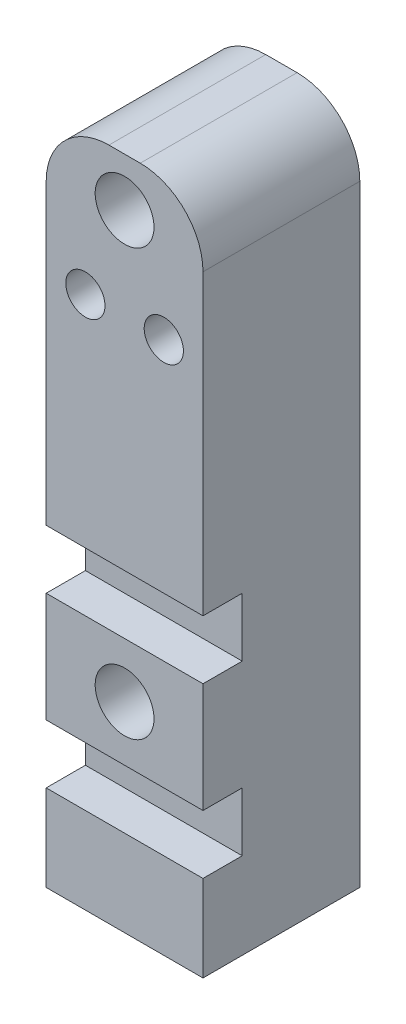
from build123d import *

# Parameters (mm, degrees)
SKETCH1_W           = 1
SKETCH1_H           = 1
BOSS_EXTRUDE1_DEPTH = 4.3
FILLET1_R           = 0.4
FILLET2_R           = 0.4
SKETCH2_R           = 0.1
CUT_EXTRUDE1_DEPTH  = 0.7
SKETCH6_W           = 1
SKETCH6_H           = 0.375
CUT_EXTRUDE2_DEPTH  = 0.25
SKETCH8_W           = 1
SKETCH8_H           = 0.375
CUT_EXTRUDE3_DEPTH  = 0.25
SKETCH9_R           = 0.1875
CUT_EXTRUDE4_DEPTH  = 1
SKETCH10_R          = 0.1875
CUT_EXTRUDE5_DEPTH  = 0.65
SKETCH11_R          = 0.125
CUT_EXTRUDE6_DEPTH  = 1


with BuildPart() as part:
    # Sketch1 → Boss-Extrude1 (new body)
    with BuildSketch(Plane(origin=(0, 0, 0), x_dir=(1, 0, 0), z_dir=(0, 1, 0))):
        Rectangle(SKETCH1_W, SKETCH1_H)
    extrude(amount=BOSS_EXTRUDE1_DEPTH)

    # Fillet1
    fillet1_edges = [part.edges().sort_by_distance(p)[0] for p in [
        (0.5, 4.3, 0),
    ]]
    fillet(fillet1_edges, radius=FILLET1_R)

    # Fillet2
    fillet2_edges = [part.edges().sort_by_distance(p)[0] for p in [
        (-0.5, 4.3, 0),
    ]]
    fillet(fillet2_edges, radius=FILLET2_R)

    # Sketch2 → Cut-Extrude1 (cut)
    with BuildSketch(Plane(origin=(0, 0, 0), x_dir=(1, 0, 0), z_dir=(0, 1, 0))):
        with Locations(Location((0, 0, 0), (0, 0, 270))):
            Circle(SKETCH2_R)
    extrude(amount=CUT_EXTRUDE1_DEPTH, mode=Mode.SUBTRACT)

    # Sketch6 → Cut-Extrude2 (cut)
    with BuildSketch(Plane.XY.offset(0.5)):
        with Locations((0, 0.7375)):
            Rectangle(SKETCH6_W, SKETCH6_H)
    extrude(amount=-CUT_EXTRUDE2_DEPTH, mode=Mode.SUBTRACT)

    # Sketch8 → Cut-Extrude3 (cut)
    with BuildSketch(Plane.XY.offset(0.5)):
        with Locations((0, 1.8125)):
            Rectangle(SKETCH8_W, SKETCH8_H)
    extrude(amount=-CUT_EXTRUDE3_DEPTH, mode=Mode.SUBTRACT)

    # Sketch9 → Cut-Extrude4 (cut)
    with BuildSketch(Plane.XY.offset(0.5)):
        with Locations((0, 1.275)):
            Circle(SKETCH9_R)
    extrude(amount=-CUT_EXTRUDE4_DEPTH, mode=Mode.SUBTRACT)

    # Sketch10 → Cut-Extrude5 (cut)
    with BuildSketch(Plane.XY.offset(0.5)):
        with Locations((0, 3.99)):
            Circle(SKETCH10_R)
    extrude(amount=-CUT_EXTRUDE5_DEPTH, mode=Mode.SUBTRACT)

    # Sketch11 → Cut-Extrude6 (cut)
    with BuildSketch(Plane.XY.offset(0.5)):
        with Locations((0.25, 3.4)):
            Circle(SKETCH11_R)
        with Locations((-0.25, 3.4)):
            Circle(SKETCH11_R)
    extrude(amount=-CUT_EXTRUDE6_DEPTH, mode=Mode.SUBTRACT)


solid = part.part
